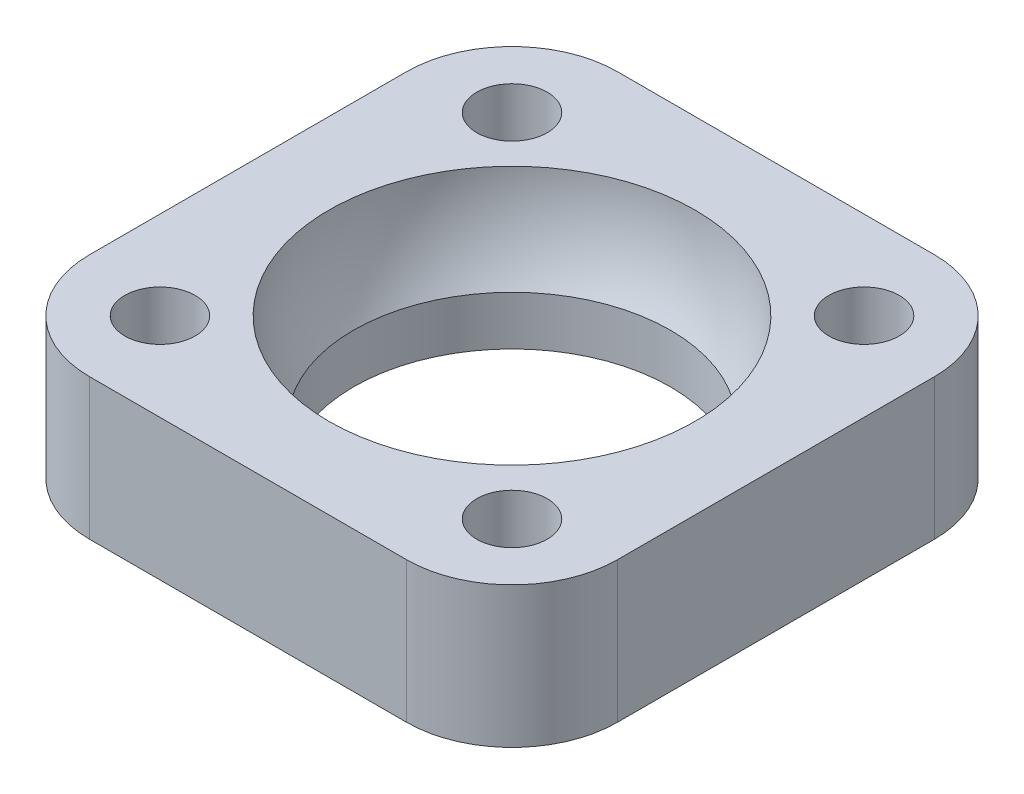
from build123d import *

# Parameters (mm, degrees)
SKETCH1_W           = 15
SKETCH1_H           = 15
BOSS_EXTRUDE1_DEPTH = 4
SKETCH3_R           = 1
CUT_EXTRUDE1_DEPTH  = 22.587033145
SKETCH4_R           = 4.5
CUT_EXTRUDE2_DEPTH  = 22.587033145
FILLET1_R           = 3


with BuildPart() as part:
    # Sketch1 → Boss-Extrude1 (new body)
    with BuildSketch(Plane(origin=(0, 0, 0), x_dir=(1, 0, 0), z_dir=(0, 1, 0))):
        with Locations((7.5, -7.5)):
            Rectangle(SKETCH1_W, SKETCH1_H)
    extrude(amount=BOSS_EXTRUDE1_DEPTH)

    # Sketch2 → Cut-Revolve1 (revolve, cut)
    with BuildSketch(Plane(origin=(0, 4, 0), x_dir=(1, 0, 0), z_dir=(0, 1, 0))):
        with BuildLine():
            Line((12.7, -7.5), (2.3, -7.5))
            ThreePointArc((2.3, -7.5), (7.5, -12.7), (12.7, -7.5))
        make_face()
    revolve(axis=Axis((12.7, 4, 7.5), (-1, 0, 0)), mode=Mode.SUBTRACT)

    # Sketch3 → Cut-Extrude1 (cut, through all)
    with BuildSketch(Plane(origin=(0, 4, 0), x_dir=(1, 0, 0), z_dir=(0, 1, 0))):
        with Locations(Location((2.5, -12.5, 0), (0, 0, 270))):
            Circle(SKETCH3_R)
        with Locations(Location((12.5, -12.5, 0), (0, 0, 270))):
            Circle(SKETCH3_R)
        with Locations(Location((12.5, -2.5, 0), (0, 0, 270))):
            Circle(SKETCH3_R)
        with Locations(Location((2.5, -2.5, 0), (0, 0, 270))):
            Circle(SKETCH3_R)
    extrude(amount=-CUT_EXTRUDE1_DEPTH, mode=Mode.SUBTRACT)

    # Sketch4 → Cut-Extrude2 (cut, through all)
    with BuildSketch(Plane(origin=(0, 0, 0), x_dir=(-1, 0, 0), z_dir=(0, -1, 0))):
        with Locations(Location((-7.5, -7.5, 0), (0, 0, 90))):
            Circle(SKETCH4_R)
    extrude(amount=-CUT_EXTRUDE2_DEPTH, mode=Mode.SUBTRACT)

    # Fillet1
    fillet1_edges = [part.edges().sort_by_distance(p)[0] for p in [
        (0, 2, 0),
        (15, 2, 0),
        (15, 2, 15),
        (0, 2, 15),
    ]]
    fillet(fillet1_edges, radius=FILLET1_R)


solid = part.part
